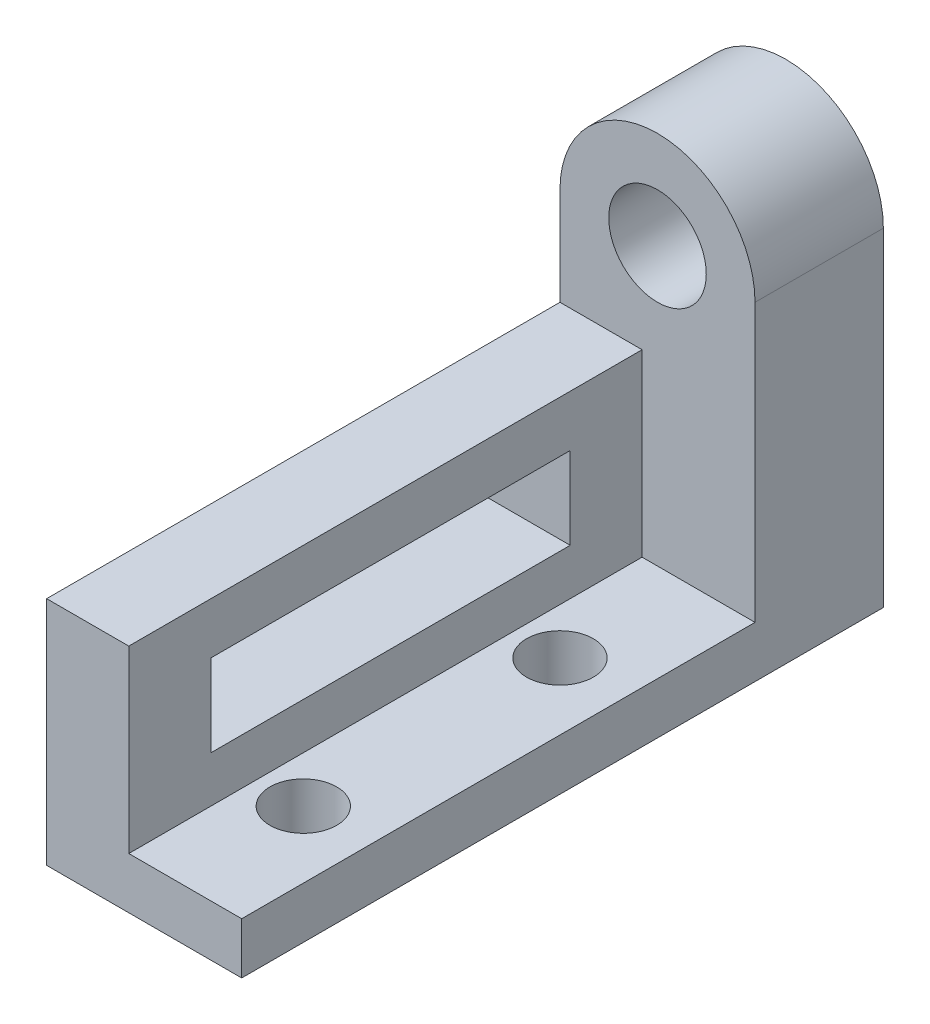
from build123d import *

# Parameters (mm, degrees)
BOSS_EXTRUDE1_DEPTH        = 38
SKETCH1_3_W                = 100
SKETCH1_3_H                = 35
SKETCH1_3_W_2              = 70
SKETCH1_3_H_2              = 16
BOSS_EXTRUDE2_DEPTH        = 16
FILLET1_RADIUS             = 19
FILLET1_LENGTH             = 25
F_19_0_19_DIAMETER_HOLE1_D = 19
F_13_0_13_DIAMETER_HOLE1_D = 13


with BuildPart() as part:
    # Sketch1 → Boss-Extrude1 (new body)
    with BuildSketch(Plane(origin=(0, 0, 0), x_dir=(0, 0, -1), z_dir=(1, 0, 0))):
        Polygon((100, 10), (100, 83), (125, 83), (125, 0), (0, 0), (0, 10), align=None)
    extrude(amount=BOSS_EXTRUDE1_DEPTH)

    # Sketch1<3> → Boss-Extrude2 (add)
    with BuildSketch(Plane(origin=(0, 0, 0), x_dir=(0, 0, -1), z_dir=(1, 0, 0))):
        with Locations((50, 27.5)):
            Rectangle(SKETCH1_3_W, SKETCH1_3_H)
        with Locations((51, 27)):
            Rectangle(SKETCH1_3_W_2, SKETCH1_3_H_2, mode=Mode.SUBTRACT)
    extrude(amount=BOSS_EXTRUDE2_DEPTH)

    # Fillet1: full round fillet: the end face becomes a half cylinder, R = half its width
    fillet1_face = Plane((19, 83, -112.5), x_dir=(0, 0, -1), z_dir=(0, 1, 0))  # on the end face: x along it, z out of the body
    fillet1_slab = fillet1_face.offset(-FILLET1_RADIUS / 2) * Box(FILLET1_LENGTH, 2 * FILLET1_RADIUS, FILLET1_RADIUS, mode=Mode.PRIVATE)  # the body's end, R deep
    fillet1_round = Plane((19, 64, -112.5), x_dir=(0, 1, 0), z_dir=(0, 0, -1)) * Cylinder(FILLET1_RADIUS, FILLET1_LENGTH, mode=Mode.PRIVATE)  # its axis R under the face
    add(fillet1_slab - fillet1_round, mode=Mode.SUBTRACT)

    # Ø19.0 (19) Diameter Hole1 (through all)
    with Locations(Plane(origin=(19, 64, -100), x_dir=(1, 0, 0), z_dir=(0, 0, 1))):
        with Locations((0, 0)):
            Hole(F_19_0_19_DIAMETER_HOLE1_D / 2)

    # Ø13.0 (13) Diameter Hole1 (through all)
    with Locations(Plane(origin=(25, 10, -25), x_dir=(0, 0, 1), z_dir=(0, 1, 0))):
        with Locations((0, 0), (-50, 0)):
            Hole(F_13_0_13_DIAMETER_HOLE1_D / 2)


solid = part.part
